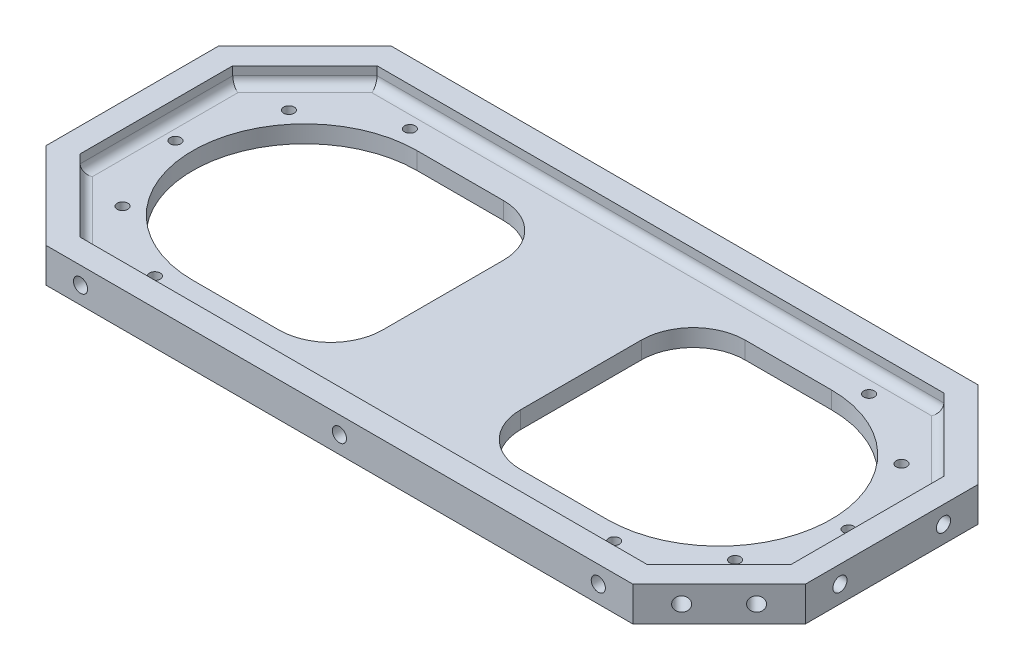
from build123d import *

# Parameters (mm, degrees)
MAIN_DEPTH                                     = 10
SKETCH3_R                                      = 1.55
ACTUATOR_SCREW_HOLE_DEPTH                      = 141.91220671
ACTUATOR_SCREW_HOLE_PATTERN_COUNT              = 3
ACTUATOR_SCREW_HOLE_PATTERN_ANGLE              = 80
ACTUATOR_SCREW_HOLE_PATTERN_THE_OTHER_WA_COUNT = 3
ACTUATOR_SCREW_HOLE_PATTERN_THE_OTHER_WA_ANGLE = 80
MIDSPAN_FILLET_R                               = 15
DISH_DEPTH                                     = 5
DISH_FILLET_R                                  = 2.5
F_4_0MM_DOWEL_HOLE1_D                          = 4.1
F_4_0MM_DOWEL_HOLE1_DEPTH                      = 5.7
F_4_0MM_DOWEL_HOLE1_ON_FACE_2_D                = 4.1
F_4_0MM_DOWEL_HOLE1_ON_FACE_2_DEPTH            = 5.7
F_4_0MM_DOWEL_HOLE1_ON_FACE_3_D                = 4.1
F_4_0MM_DOWEL_HOLE1_ON_FACE_3_DEPTH            = 5.7
F_4_0MM_DOWEL_HOLE1_ON_FACE_4_D                = 4.1
F_4_0MM_DOWEL_HOLE1_ON_FACE_4_DEPTH            = 5.7
F_4_0MM_DOWEL_HOLE1_ON_FACE_5_D                = 4.1
F_4_0MM_DOWEL_HOLE1_ON_FACE_5_DEPTH            = 5.7
F_4_0MM_DOWEL_HOLE1_ON_FACE_6_D                = 4.1
F_4_0MM_DOWEL_HOLE1_ON_FACE_6_DEPTH            = 5.7
F_4_0MM_DOWEL_HOLE1_ON_FACE_7_D                = 4.1
F_4_0MM_DOWEL_HOLE1_ON_FACE_7_DEPTH            = 5.7
F_4_0MM_DOWEL_HOLE1_ON_FACE_8_D                = 4.1
F_4_0MM_DOWEL_HOLE1_ON_FACE_8_DEPTH            = 5.7
F_4_0MM_DOWEL_HOLE1_ON_FACE_9_D                = 4.1
F_4_0MM_DOWEL_HOLE1_ON_FACE_9_DEPTH            = 5.7
F_4_0MM_DOWEL_HOLE1_ON_FACE_10_D               = 4.1
F_4_0MM_DOWEL_HOLE1_ON_FACE_10_DEPTH           = 5.7


with BuildPart() as part:
    # Sketch1 → Main (new body)
    with BuildSketch(Plane(origin=(0, 0, 0), x_dir=(1, 0, 0), z_dir=(0, 1, 0))):
        Polygon((0, 12.5), (0, 0), (0, -75), (0, -87.5), (85, -87.5), (110, -62.5), (110, -12.5), (85, 12.5), align=None)
        with BuildLine():
            Line((60, -5), (20, -5))
            Line((20, -5), (20, -70))
            Line((20, -70), (60, -70))
            ThreePointArc((60, -70), (92.5, -37.5), (60, -5))
        make_face(mode=Mode.SUBTRACT)
    extrude(amount=MAIN_DEPTH)

    # Sketch3 → Actuator Screw Hole (cut, through all)
    with BuildSketch(Plane(origin=(0, 10, 0), x_dir=(1, 0, 0), z_dir=(0, 1, 0))):
        with Locations(Location((97.5, -37.5, 0), (0, 0, 270))):
            Circle(SKETCH3_R)
    actuator_screw_hole = extrude(amount=-ACTUATOR_SCREW_HOLE_DEPTH, mode=Mode.SUBTRACT)

    # Actuator Screw Hole Pattern: Actuator Screw Hole ×3 about axis
    actuator_screw_hole_pattern_axis = Axis((60, 0, 37.5), (0, 1, 0))
    for i in range(1, ACTUATOR_SCREW_HOLE_PATTERN_COUNT):
        add(actuator_screw_hole.rotate(actuator_screw_hole_pattern_axis, i * ACTUATOR_SCREW_HOLE_PATTERN_ANGLE / (ACTUATOR_SCREW_HOLE_PATTERN_COUNT - 1)), mode=Mode.SUBTRACT)

    # Actuator Screw Hole Pattern the other wa: Actuator Screw Hole ×3 about axis
    actuator_screw_hole_pattern_the_other_wa_axis = Axis((60, 0, 37.5), (0, -1, 0))
    for i in range(1, ACTUATOR_SCREW_HOLE_PATTERN_THE_OTHER_WA_COUNT):
        add(actuator_screw_hole.rotate(actuator_screw_hole_pattern_the_other_wa_axis, i * ACTUATOR_SCREW_HOLE_PATTERN_THE_OTHER_WA_ANGLE / (ACTUATOR_SCREW_HOLE_PATTERN_THE_OTHER_WA_COUNT - 1)), mode=Mode.SUBTRACT)

    # Midspan fillet
    midspan_fillet_edges = [part.edges().sort_by_distance(p)[0] for p in [
        (20, 5, 5),
        (20, 5, 70),
    ]]
    fillet(midspan_fillet_edges, radius=MIDSPAN_FILLET_R)

    # Mirror1: part across plane


with BuildPart() as part_1:
    add(part.part)
    add(part.part.mirror(Plane(origin=(0, 0, 0), x_dir=(0, 0, 1), z_dir=(1, 0, 0))))

    # Sketch8 → Dish (cut)
    with BuildSketch(Plane(origin=(0, 10, 0), x_dir=(1, 0, 0), z_dir=(0, 1, 0))):
        Polygon((82.100505063, 5.5), (-82.100505063, 5.5), (-103, -15.399494937), (-103, -59.600505063), (-82.100505063, -80.5), (82.100505063, -80.5), (103, -59.600505063), (103, -15.399494937), align=None)
    extrude(amount=-DISH_DEPTH, mode=Mode.SUBTRACT)

    # Dish fillet
    dish_fillet_edges = [part_1.edges().sort_by_distance(p)[0] for p in [
        (92.550252532, 5, 4.949747468),
        (103, 5, 37.5),
        (92.550252532, 5, 70.050252532),
        (0, 5, 80.5),
        (-92.550252532, 5, 70.050252532),
        (-103, 5, 37.5),
        (-92.550252532, 5, 4.949747468),
        (0, 5, -5.5),
    ]]
    fillet(dish_fillet_edges, radius=DISH_FILLET_R)

    # Ø4.0mm Dowel Hole1
    with Locations(Plane(origin=(75, 5, -12.5), x_dir=(-1, 0, 0), z_dir=(0, 0, -1))):
        with Locations((0, 0), (75, 0), (150, 0)):
            Hole(F_4_0MM_DOWEL_HOLE1_D / 2, depth=F_4_0MM_DOWEL_HOLE1_DEPTH)

    # Ø4.0mm Dowel Hole1 on face 2
    with Locations(Plane(origin=(-92.071067812, 5, -5.428932188), x_dir=(-0.707106781187, 0, 0.707106781187), z_dir=(-0.707106781187, 0, -0.707106781187))):
        with Locations((0, 0), (15.355339059, 0)):
            Hole(F_4_0MM_DOWEL_HOLE1_ON_FACE_2_D / 2, depth=F_4_0MM_DOWEL_HOLE1_ON_FACE_2_DEPTH)

    # Ø4.0mm Dowel Hole1 on face 3
    with Locations(Plane(origin=(-110, 5, 22.5), x_dir=(0, 0, -1), z_dir=(-1, 0, 0))):
        with Locations((0, 0), (-30, 0)):
            Hole(F_4_0MM_DOWEL_HOLE1_ON_FACE_3_D / 2, depth=F_4_0MM_DOWEL_HOLE1_ON_FACE_3_DEPTH)

    # Ø4.0mm Dowel Hole1 on face 4
    with Locations(Plane(origin=(-102.928932188, 5, 69.571067812), x_dir=(0.707106781187, 0, 0.707106781187), z_dir=(-0.707106781187, 0, 0.707106781187))):
        with Locations((0, 0)):
            Hole(F_4_0MM_DOWEL_HOLE1_ON_FACE_4_D / 2, depth=F_4_0MM_DOWEL_HOLE1_ON_FACE_4_DEPTH)

    # Ø4.0mm Dowel Hole1 on face 5
    with Locations(Plane(origin=(-92.071067812, 5, 80.428932188), x_dir=(0.707106781187, 0, 0.707106781187), z_dir=(-0.707106781187, 0, 0.707106781187))):
        with Locations((0, 0)):
            Hole(F_4_0MM_DOWEL_HOLE1_ON_FACE_5_D / 2, depth=F_4_0MM_DOWEL_HOLE1_ON_FACE_5_DEPTH)

    # Ø4.0mm Dowel Hole1 on face 6
    with Locations(Plane(origin=(-75, 5, 87.5), x_dir=(1, 0, 0), z_dir=(0, 0, 1))):
        with Locations((0, 0), (75, 0), (150, 0)):
            Hole(F_4_0MM_DOWEL_HOLE1_ON_FACE_6_D / 2, depth=F_4_0MM_DOWEL_HOLE1_ON_FACE_6_DEPTH)

    # Ø4.0mm Dowel Hole1 on face 7
    with Locations(Plane(origin=(92.071067812, 5, 80.428932188), x_dir=(0.707106781187, 0, -0.707106781187), z_dir=(0.707106781187, 0, 0.707106781187))):
        with Locations((0, 0)):
            Hole(F_4_0MM_DOWEL_HOLE1_ON_FACE_7_D / 2, depth=F_4_0MM_DOWEL_HOLE1_ON_FACE_7_DEPTH)

    # Ø4.0mm Dowel Hole1 on face 8
    with Locations(Plane(origin=(102.928932188, 5, 69.571067812), x_dir=(0.707106781187, 0, -0.707106781187), z_dir=(0.707106781187, 0, 0.707106781187))):
        with Locations((0, 0)):
            Hole(F_4_0MM_DOWEL_HOLE1_ON_FACE_8_D / 2, depth=F_4_0MM_DOWEL_HOLE1_ON_FACE_8_DEPTH)

    # Ø4.0mm Dowel Hole1 on face 9
    with Locations(Plane(origin=(110, 5, 52.5), x_dir=(0, 0, 1), z_dir=(1, 0, 0))):
        with Locations((0, 0), (-30, 0)):
            Hole(F_4_0MM_DOWEL_HOLE1_ON_FACE_9_D / 2, depth=F_4_0MM_DOWEL_HOLE1_ON_FACE_9_DEPTH)

    # Ø4.0mm Dowel Hole1 on face 10
    with Locations(Plane(origin=(102.928932188, 5, 5.428932188), x_dir=(-0.707106781187, 0, -0.707106781187), z_dir=(0.707106781187, 0, -0.707106781187))):
        with Locations((0, 0), (15.355339059, 0)):
            Hole(F_4_0MM_DOWEL_HOLE1_ON_FACE_10_D / 2, depth=F_4_0MM_DOWEL_HOLE1_ON_FACE_10_DEPTH)


solid = part_1.part
